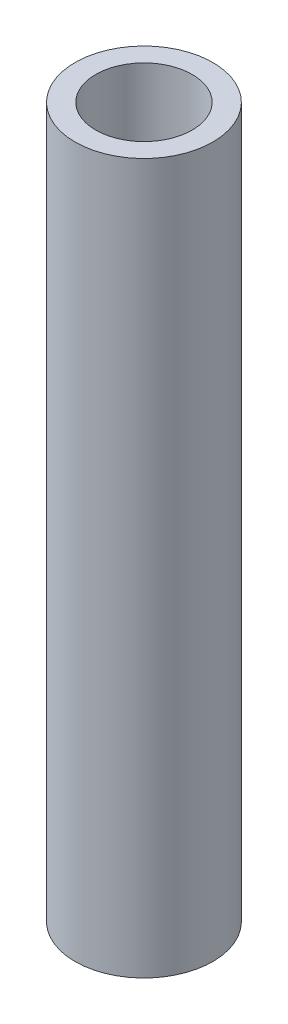
from build123d import *

# Parameters (mm, degrees)
SKETCH1_R           = 10
BOSS_EXTRUDE1_DEPTH = 3
SKETCH2_R           = 10
SKETCH2_R_2         = 7
BOSS_EXTRUDE2_DEPTH = 100


with BuildPart() as part:
    # Sketch1 → Boss-Extrude1 (new body)
    with BuildSketch(Plane(origin=(0, 0, 0), x_dir=(1, 0, 0), z_dir=(0, 1, 0))):
        with Locations(Location((0, 0, 0), (0, 0, 270))):
            Circle(SKETCH1_R)
    extrude(amount=BOSS_EXTRUDE1_DEPTH)

    # Sketch2 → Boss-Extrude2 (add)
    with BuildSketch(Plane(origin=(0, 3, 0), x_dir=(1, 0, 0), z_dir=(0, 1, 0))):
        with Locations(Location((0, 0, 0), (0, 0, 270))):
            Circle(SKETCH2_R)
        with Locations(Location((0, 0, 0), (0, 0, 270))):
            Circle(SKETCH2_R_2, mode=Mode.SUBTRACT)
    extrude(amount=BOSS_EXTRUDE2_DEPTH)


solid = part.part
